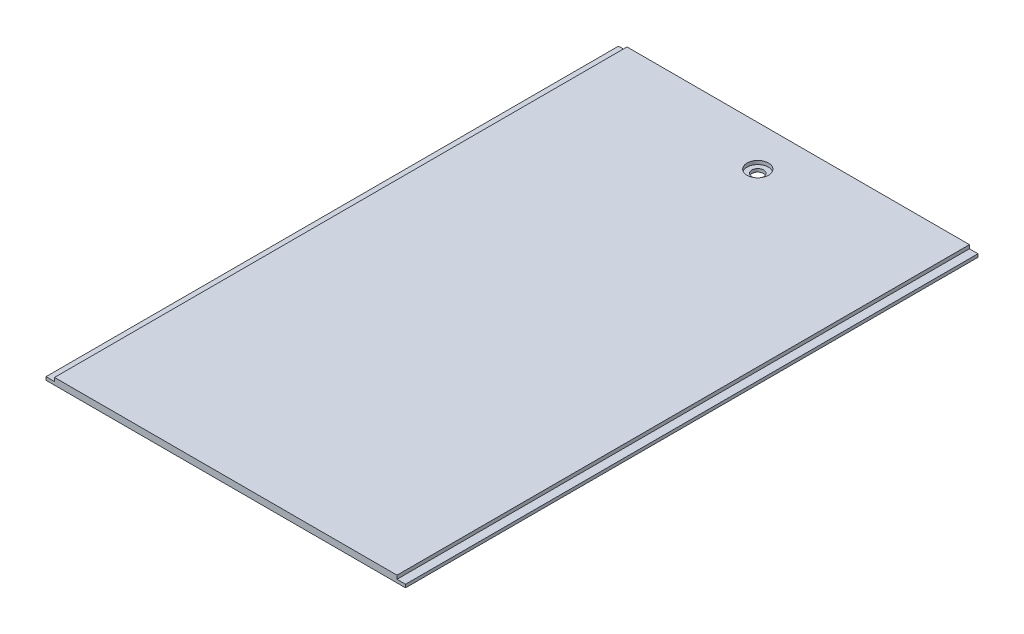
from build123d import *

# Parameters (mm, degrees)
SKETCH_1_W          = 76.15
SKETCH_1_H          = 127.3
EXTRUDE_1_DEPTH     = 1.5
SKETCH_2_W          = 1.9
SKETCH_2_H          = 0.7
EXTRUDE_2_DEPTH     = 127.3
SKETCH_3_R          = 1.3
CUT_EXTRUDE_1_DEPTH = 76.176945435
SKETCH_5_R          = 2.375
CUT_EXTRUDE_2_DEPTH = 0.8


with BuildPart() as part:
    # Эскиз1 → Бобышка-Вытянуть1 (new body)
    with BuildSketch(Plane(origin=(0, 0, 0), x_dir=(1, 0, 0), z_dir=(0, 1, 0))):
        Rectangle(SKETCH_1_W, SKETCH_1_H)
    extrude(amount=EXTRUDE_1_DEPTH)

    # Эскиз2 → Бобышка-Вытянуть2 (add)
    with BuildSketch(Plane.XY.offset(63.65)):
        with Locations((-39.025, 0.35)):
            Rectangle(SKETCH_2_W, SKETCH_2_H)
        with Locations((39.025, 0.35)):
            Rectangle(SKETCH_2_W, SKETCH_2_H)
    extrude(amount=-EXTRUDE_2_DEPTH)

    # Эскиз3 → Вырез-Вытянуть1 (cut, through all)
    with BuildSketch(Plane(origin=(0, 1.5, 0), x_dir=(1, 0, 0), z_dir=(0, 1, 0))):
        with Locations(Location((0, 54.65, 0), (0, 0, 270))):
            Circle(SKETCH_3_R)
    extrude(amount=-CUT_EXTRUDE_1_DEPTH, mode=Mode.SUBTRACT)

    # Эскиз5 → Вырез-Вытянуть2 (cut)
    with BuildSketch(Plane(origin=(0, 1.5, 0), x_dir=(1, 0, 0), z_dir=(0, 1, 0))):
        with Locations(Location((0, 54.65, 0), (0, 0, 270))):
            Circle(SKETCH_5_R)
    extrude(amount=-CUT_EXTRUDE_2_DEPTH, mode=Mode.SUBTRACT)


solid = part.part
